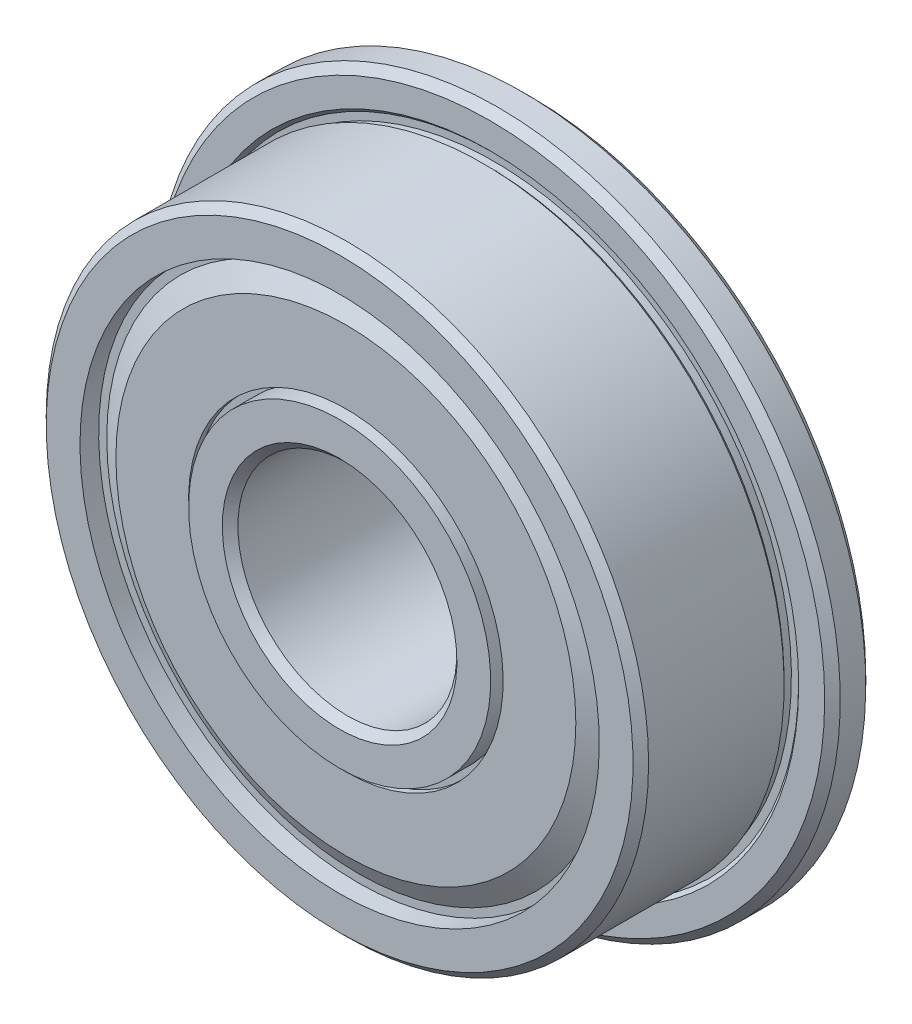
from build123d import *

# Parameters (mm, degrees)
FILLET1_SIZE      = 0.284375
FILLET2_SIZE      = 0.284375
CIRPATTERN3_COUNT = 8
SKETCH8_W         = 0.91
SKETCH8_H         = 0.758333333


with BuildPart() as part:
    # Sketch2 → Revolve1 (revolve)
    with BuildSketch(Plane(origin=(0, 0, 0), x_dir=(0, 0, -1), z_dir=(1, 0, 0)), mode=Mode.PRIVATE) as revolve1_sk:
        with BuildLine():
            Line((3.5, 12.5), (2, 12.5))
            Line((2, 12.5), (2, 11.265165043))
            Line((2, 11.265165043), (2.132582521, 11.132582521))
            Line((2.132582521, 11.132582521), (2.132582521, 10.867417479))
            Line((2.132582521, 10.867417479), (1.867417479, 10.867417479))
            Line((1.867417479, 10.867417479), (1.734834957, 11))
            Line((1.734834957, 11), (-3.5, 11))
            Line((-3.5, 11), (-3.5, 8.725))
            Line((-3.5, 8.725), (-1.561286409, 8.725))
            ThreePointArc((-1.561286409, 8.725), (0, 9.4845), (1.561286409, 8.725))
            Line((1.561286409, 8.725), (3.5, 8.725))
            Line((3.5, 8.725), (3.5, 12.5))
        make_face()
        with BuildLine():
            Line((3.5, 4), (-3.5, 4))
            Line((-3.5, 4), (-3.5, 6.275))
            Line((-3.5, 6.275), (-1.561286409, 6.275))
            ThreePointArc((-1.561286409, 6.275), (0, 5.5155), (1.561286409, 6.275))
            Line((1.561286409, 6.275), (3.5, 6.275))
            Line((3.5, 6.275), (3.5, 4))
        make_face()
    revolve(revolve1_sk.sketch.rotate(Axis((0, 0, 0), (0, 0, -1)), 180), axis=Axis((0, 0, 0), (0, 0, -1)))

    # Fillet1
    fillet1_edges = [part.edges().sort_by_distance(p)[0] for p in [
        (0, 11, 3.5),
        (0, 12.5, -3.5),
        (0, 12.5, -2),
    ]]
    chamfer(fillet1_edges, length=FILLET1_SIZE)

    # Fillet2
    fillet2_edges = [part.edges().sort_by_distance(p)[0] for p in [
        (0, 4, -3.5),
        (0, 4, 3.5),
    ]]
    chamfer(fillet2_edges, length=FILLET2_SIZE)

    # Sketch8 → Cut-Revolve1 (revolve, cut)
    with BuildSketch(Plane(origin=(0, 0, 0), x_dir=(0, 0, -1), z_dir=(1, 0, 0)), mode=Mode.PRIVATE) as cut_revolve1_sk:
        with Locations((-3.045, 9.104166667)):
            Rectangle(SKETCH8_W, SKETCH8_H)
        with Locations((3.045, 9.104166667)):
            Rectangle(SKETCH8_W, SKETCH8_H)
        with Locations((3.045, 5.895833334)):
            Rectangle(SKETCH8_W, SKETCH8_H)
        with Locations((-3.045, 5.895833334)):
            Rectangle(SKETCH8_W, SKETCH8_H)
    revolve(cut_revolve1_sk.sketch.rotate(Axis((0, 0, 0), (0, 0, -1)), 180), axis=Axis((0, 0, 0), (0, 0, -1)), mode=Mode.SUBTRACT)


with BuildPart() as body_2:
    # Sketch7 → Revolve3 (revolve)
    with BuildSketch(Plane.XY):
        with BuildLine():
            Line((0, 9.4845), (0, 5.5155))
            ThreePointArc((0, 5.5155), (-1.9845, 7.5), (0, 9.4845))
        make_face()
    revolve(axis=Axis((0, 9.4845, 0), (0, -1, 0)))


with BuildPart() as cirpattern3_1:
    # CirPattern3: pattern copy
    add(body_2.part.rotate(Axis((0, 0, 0), (0, 0, 1)), 1 * 360 / CIRPATTERN3_COUNT))


with BuildPart() as cirpattern3_2:
    # CirPattern3: pattern copy
    add(body_2.part.rotate(Axis((0, 0, 0), (0, 0, 1)), 2 * 360 / CIRPATTERN3_COUNT))


with BuildPart() as cirpattern3_3:
    # CirPattern3: pattern copy
    add(body_2.part.rotate(Axis((0, 0, 0), (0, 0, 1)), 3 * 360 / CIRPATTERN3_COUNT))


with BuildPart() as cirpattern3_4:
    # CirPattern3: pattern copy
    add(body_2.part.rotate(Axis((0, 0, 0), (0, 0, 1)), 4 * 360 / CIRPATTERN3_COUNT))


with BuildPart() as cirpattern3_5:
    # CirPattern3: pattern copy
    add(body_2.part.rotate(Axis((0, 0, 0), (0, 0, 1)), 5 * 360 / CIRPATTERN3_COUNT))


with BuildPart() as cirpattern3_6:
    # CirPattern3: pattern copy
    add(body_2.part.rotate(Axis((0, 0, 0), (0, 0, 1)), 6 * 360 / CIRPATTERN3_COUNT))


with BuildPart() as cirpattern3_7:
    # CirPattern3: pattern copy
    add(body_2.part.rotate(Axis((0, 0, 0), (0, 0, 1)), 7 * 360 / CIRPATTERN3_COUNT))


with BuildPart() as body_10:
    # Sketch9 → Revolve4 (revolve)
    with BuildSketch(Plane(origin=(0, 0, 0), x_dir=(0, 0, -1), z_dir=(1, 0, 0)), mode=Mode.PRIVATE) as revolve4_sk:
        Polygon((-2.59, 9.483333333), (-2.59, 9.126190476), (-3.045, 8.338107359), (-3.045, 5.744166667), (-3.2725, 5.744166667), (-3.2725, 8.3990658), (-2.8175, 9.187148917), (-2.8175, 9.483333333), align=None)
        Polygon((2.59, 9.483333333), (2.59, 9.126190476), (3.045, 8.338107359), (3.045, 5.744166667), (3.2725, 5.744166667), (3.2725, 8.3990658), (2.8175, 9.187148917), (2.8175, 9.483333333), align=None)
    revolve(revolve4_sk.sketch.rotate(Axis((0, 0, 0), (0, 0, -1)), 180), axis=Axis((0, 0, 0), (0, 0, -1)))


solid = Compound([part.part, body_2.part, cirpattern3_1.part, cirpattern3_2.part, cirpattern3_3.part, cirpattern3_4.part, cirpattern3_5.part, cirpattern3_6.part, cirpattern3_7.part, body_10.part])
